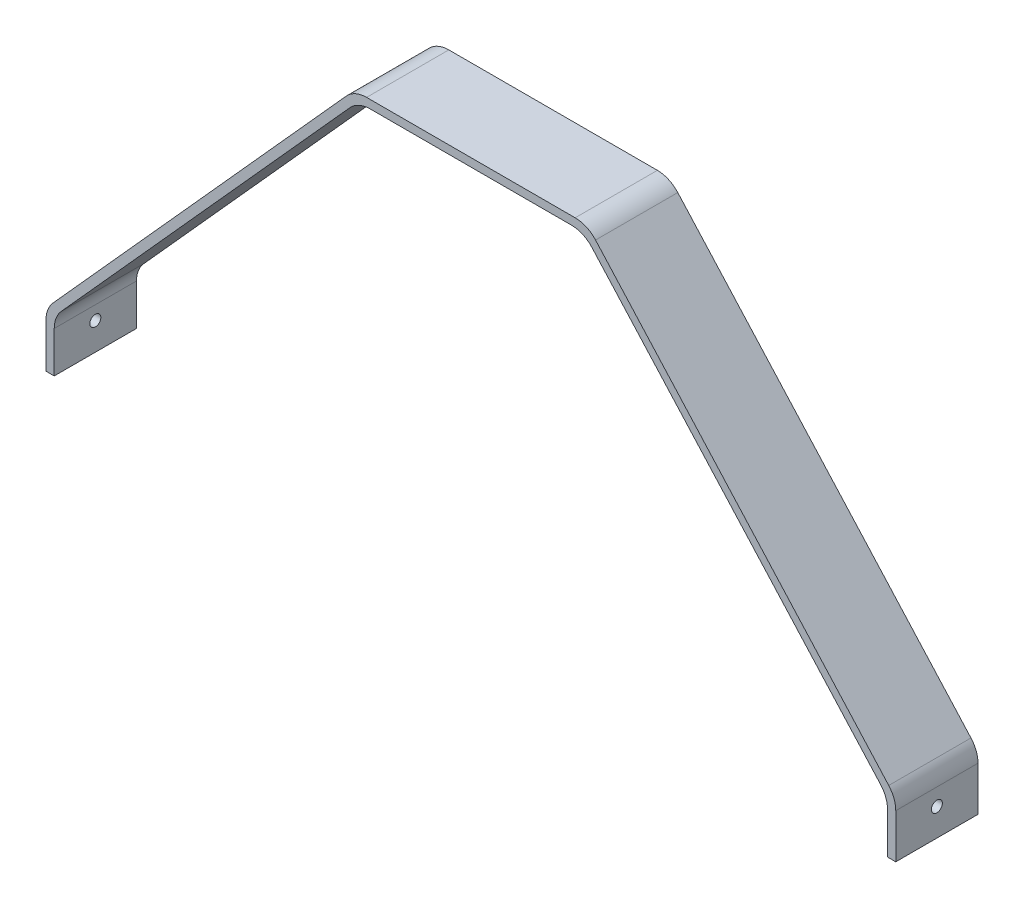
from build123d import *

# Parameters (mm, degrees)
BOSS_EXTRUDE1_DEPTH     = 30
FILLET1_R               = 10
CUT_EXTRUDE1_DEPTH      = 344.547667726
CUT_EXTRUDE1_DEPTH_BACK = 344.547667726
SKETCH2_R               = 2


with BuildPart() as part:
    # Sketch1 → Boss-Extrude1 (new body)
    with BuildSketch(Plane.XY):
        Polygon((155, -145), (152, -145), (152, -126.151208016), (41.163912786, -3), (-41.163912786, -3), (-152, -126.151208016), (-152, -145), (-155, -145), (-155, -125), (-42.5, 0), (42.5, 0), (155, -125), align=None)
    extrude(amount=BOSS_EXTRUDE1_DEPTH)

    # Fillet1
    fillet1_edges = [part.edges().sort_by_distance(p)[0] for p in [
        (152, -126.151208016, 15),
        (41.163912786, -3, 15),
        (-41.163912786, -3, 15),
        (-152, -126.151208016, 15),
        (-155, -125, 15),
        (-42.5, 0, 15),
        (42.5, 0, 15),
        (155, -125, 15),
    ]]
    fillet(fillet1_edges, radius=FILLET1_R)

    # Sketch2 → Cut-Extrude1 (cut, two sides: drawn at the far end of the back side and taken through both)
    with BuildSketch(Plane(origin=(155, 0, 0), x_dir=(0, 0, -1), z_dir=(1, 0, 0)).offset(-CUT_EXTRUDE1_DEPTH_BACK)):
        with Locations((-15, -135)):
            Circle(SKETCH2_R)
    extrude(amount=CUT_EXTRUDE1_DEPTH + CUT_EXTRUDE1_DEPTH_BACK, mode=Mode.SUBTRACT)


solid = part.part
